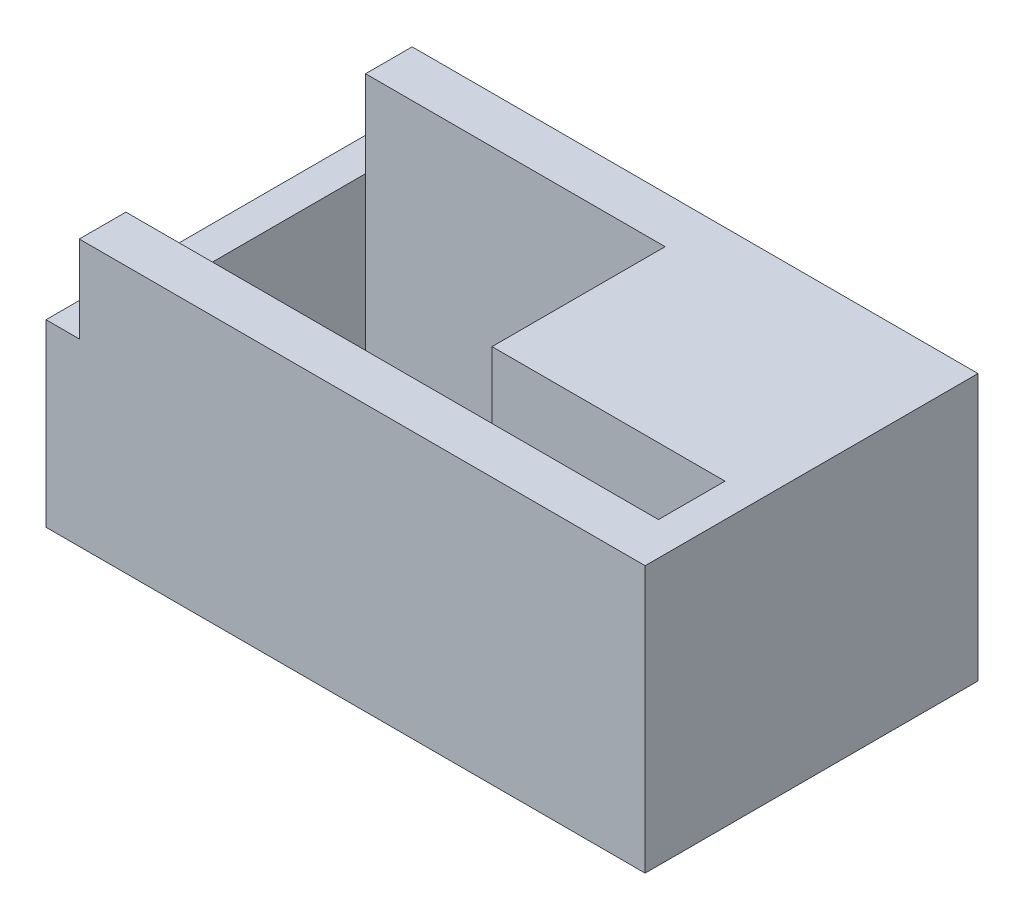
from build123d import *

# Parameters (mm, degrees)
SKETCH_1_W          = 50
SKETCH_1_H          = 40
EXTRUDE_1_DEPTH     = 85
CUT_EXTRUDE_1_DEPTH = 60
EXTRUDE_2_DEPTH     = 25
SKETCH_4_W          = 50
SKETCH_4_H          = 27
EXTRUDE_3_DEPTH     = 5


with BuildPart() as part:
    # 草图1 → 凸台-拉伸1 (new body)
    with BuildSketch(Plane(origin=(0, 0, 0), x_dir=(0, 0, -1), z_dir=(1, 0, 0))):
        with Locations((-25, 20)):
            Rectangle(SKETCH_1_W, SKETCH_1_H)
    extrude(amount=EXTRUDE_1_DEPTH)

    # 草图2 → 切除-拉伸1 (cut)
    with BuildSketch(Plane(origin=(0, 40, 0), x_dir=(1, 0, 0), z_dir=(0, 1, 0))):
        Polygon((45, -7), (0, -7), (0, -35), (0, -43), (80, -43), (80, -33), (45, -33), align=None)
    extrude(amount=-CUT_EXTRUDE_1_DEPTH, mode=Mode.SUBTRACT)

    # 草图3 → 凸台-拉伸2 (add)
    with BuildSketch(Plane.XZ):
        Polygon((0, 43), (45, 43), (80, 43), (80, 33), (45, 33), (45, 28), (0, 28), align=None)
    extrude(amount=-EXTRUDE_2_DEPTH)

    # 草图4 → 凸台-拉伸3 (add)
    with BuildSketch(Plane.ZY):
        with Locations((25, 13.5)):
            Rectangle(SKETCH_4_W, SKETCH_4_H)
    extrude(amount=EXTRUDE_3_DEPTH)


solid = part.part
